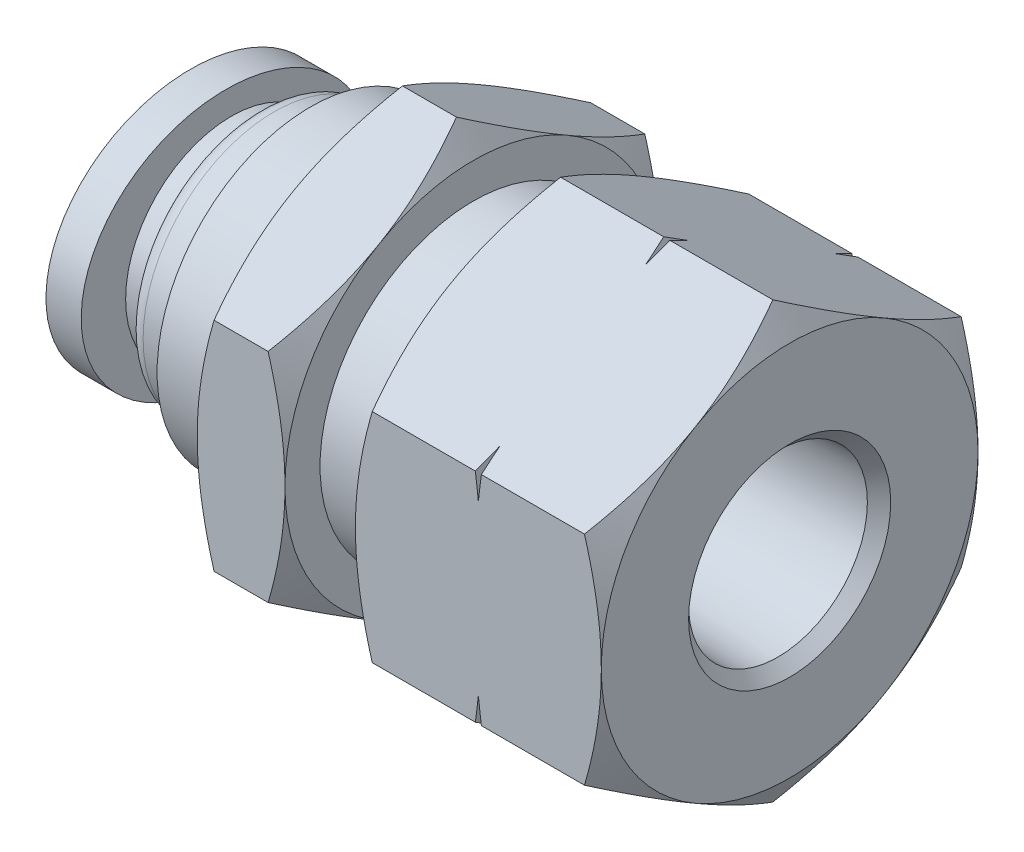
from build123d import *

# Parameters (mm, degrees)
BOSS_EXTRUDE1_DEPTH = 13.49375
CHAMFER1_SIZE       = 0.508
CHAMFER1_SIZE2      = 0.525425432
SKETCH3_RX          = 6.50875
SKETCH3_RY          = 5.6769
SKETCH3_R           = 3.3147
BOSS_EXTRUDE2_DEPTH = 1.5875


with BuildPart() as part:
    # Sketch1 → Boss-Extrude1 (new, symmetric)
    with BuildSketch(Plane(origin=(0, 0, 0), x_dir=(0, 0, -1), z_dir=(1, 0, 0))):
        Polygon((0, 9.796017487), (-8.4836, 4.898008744), (-8.4836, -4.898008744), (0, -9.796017487), (8.4836, -4.898008744), (8.4836, 4.898008744), align=None)
    extrude(amount=BOSS_EXTRUDE1_DEPTH, both=True)

    # Sketch2 → Cut-Revolve1 (revolve, cut)
    with BuildSketch(Plane.XY, mode=Mode.PRIVATE) as cut_revolve1_sk:
        Polygon((13.49375, 9.796017487), (13.49375, 8.4836), (12.73602541, 9.796017487), align=None)
        Polygon((3.17707459, 9.796017487), (-1.51337459, 9.796017487), (-0.75565, 8.4836), (-0.75565, 6.90245), (2.41935, 6.90245), (2.41935, 8.4836), align=None)
        Polygon((7.82043181, 9.796017487), (7.95655, 9.288017487), (8.09266819, 9.796017487), align=None)
        with BuildLine():
            Line((-3.94762541, 9.796017487), (-4.70535, 8.4836))
            Line((-4.70535, 8.4836), (-4.70535, 6.90245))
            Line((-4.70535, 6.90245), (-8.09625, 6.90245))
            Line((-8.09625, 6.90245), (-8.09625, 5.9055))
            Line((-8.09625, 5.9055), (-9.72185, 5.9055))
            ThreePointArc((-9.72185, 5.9055), (-10.260665367, 5.682315367), (-10.48385, 5.1435))
            Line((-10.48385, 5.1435), (-10.48385, 4.7625))
            Line((-10.48385, 4.7625), (-11.65225, 4.7625))
            Line((-11.65225, 4.7625), (-11.65225, 3.81))
            Line((-11.65225, 3.81), (-13.49375, 3.81))
            Line((-13.49375, 3.81), (-13.49375, 9.796017487))
            Line((-13.49375, 9.796017487), (-3.94762541, 9.796017487))
        make_face()
        Polygon((13.49375, 4.043670494), (4.19735, 3.74015), (3.497110726, 2.5273), (2.25425, 2.5273), (2.25425, 3.81), (-5.87375, 3.81), (-5.87375, 3.3147), (-13.49375, 3.3147), (-13.49375, 0), (13.49375, 0), align=None)
    revolve(cut_revolve1_sk.sketch.rotate(Axis((13.49375, 0, 0), (-1, 0, 0)), 90), axis=Axis((13.49375, 0, 0), (-1, 0, 0)), mode=Mode.SUBTRACT)

    # Chamfer1
    chamfer1_edges = [part.edges().sort_by_distance(p)[0] for p in [
        (13.49375, 0, 4.043670494),
    ]]
    chamfer1_side = [part.faces().sort_by_distance(p)[0] for p in [
        (13.49375, 8.243647556, -1.25e-07),
    ]]
    chamfer(chamfer1_edges, length=CHAMFER1_SIZE, length2=CHAMFER1_SIZE2, reference=chamfer1_side[0])

    # Sketch3 → Boss-Extrude2 (add)
    with BuildSketch(Plane.ZY.offset(13.49375)):
        with Locations(Location((0, 0), (0, 0, 180))):
            Ellipse(SKETCH3_RX, SKETCH3_RY)
        with Locations(Location((0, 0, 0), (0, 0, 180))):
            Circle(SKETCH3_R, mode=Mode.SUBTRACT)
    extrude(amount=-BOSS_EXTRUDE2_DEPTH)


solid = part.part
